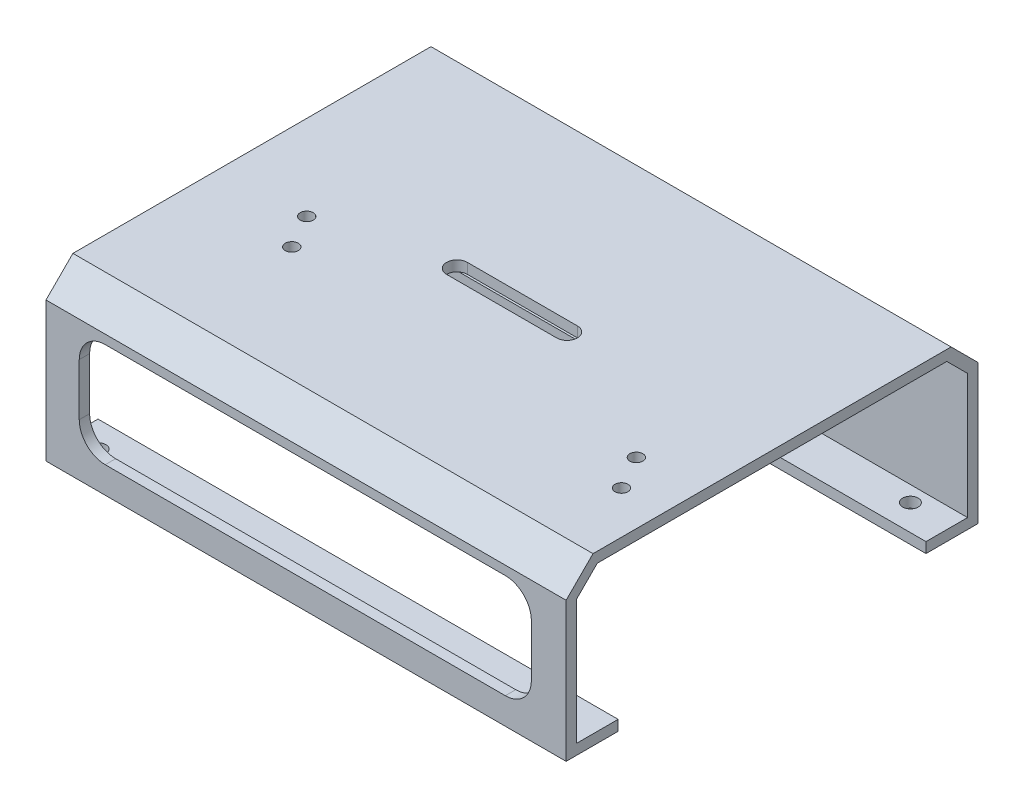
from build123d import *

# Parameters (mm, degrees)
BOSS_EXTRUDE1_DEPTH = 100
SKETCH5_R           = 1.5
CUT_EXTRUDE3_DEPTH  = 4
CUT_EXTRUDE5_REACH  = 130.673
CUT_EXTRUDE6_REACH  = 115.839
SKETCH11_R          = 1.25
CUT_EXTRUDE4_DEPTH  = 2


with BuildPart() as part:
    # Sketch1 → Boss-Extrude1 (new body)
    with BuildSketch(Plane(origin=(0, 0, 0), x_dir=(0, 0, -1), z_dir=(1, 0, 0))):
        Polygon((-25.195982579, -13.090802774), (-33.195982579, -13.090802774), (-33.195982579, 10.909197226), (-29.195982579, 14.909197226), (37.992717903, 14.909197226), (41.992717903, 10.909197226), (41.992717903, -13.090802774), (33.992717903, -13.090802774), (33.992717903, -15.090802774), (43.992717903, -15.090802774), (43.992717903, 11.73762435), (38.821145028, 16.909197226), (-30.024409703, 16.909197226), (-35.195982579, 11.73762435), (-35.195982579, -15.090802774), (-25.195982579, -15.090802774), align=None)
    extrude(amount=BOSS_EXTRUDE1_DEPTH)

    # Sketch5 → Cut-Extrude3 (cut)
    with BuildSketch(Plane.XZ.offset(15.090802774)):
        with Locations((5, 30.195982579)):
            Circle(SKETCH5_R)
        with Locations((92, 30.195982579)):
            Circle(SKETCH5_R)
        with Locations((92, -38.992717903)):
            Circle(SKETCH5_R)
        with Locations((5, -38.992717903)):
            Circle(SKETCH5_R)
    extrude(amount=-CUT_EXTRUDE3_DEPTH, mode=Mode.SUBTRACT)

    # Sketch10 → Cut-Extrude5 (cut, up to next)
    with BuildSketch(Plane.XY.offset(35.195982579), mode=Mode.PRIVATE) as cut_extrude5_sk1:
        with BuildLine():
            Line((11.390334367, 10), (88.31435142, 10))
            ThreePointArc((88.31435142, 10), (91.849885326, 8.535533906), (93.31435142, 5))
            Line((93.31435142, 5), (93.31435142, -5))
            ThreePointArc((93.31435142, -5), (91.849885326, -8.535533906), (88.31435142, -10))
            Line((88.31435142, -10), (11.390334367, -10))
            ThreePointArc((11.390334367, -10), (7.854800461, -8.535533906), (6.390334367, -5))
            Line((6.390334367, -5), (6.390334367, 5))
            ThreePointArc((6.390334367, 5), (7.854800461, 8.535533906), (11.390334367, 10))
        make_face()
    cut_extrude5_tool1 = extrude(cut_extrude5_sk1.sketch, amount=-CUT_EXTRUDE5_REACH, mode=Mode.PRIVATE) & part.part
    add(cut_extrude5_tool1.solids().sort_by_distance((49.852343, 0, 35.195983))[0], mode=Mode.SUBTRACT)

    # Sketch11 → Cut-Extrude6 (cut, up to next)
    with BuildSketch(Plane(origin=(0, 16.909197226, 0), x_dir=(1, 0, 0), z_dir=(0, 1, 0)), mode=Mode.PRIVATE) as cut_extrude6_sk1:
        with Locations((19.971775687, -7.910031108)):
            Circle(SKETCH11_R)
    cut_extrude6_tool1 = extrude(cut_extrude6_sk1.sketch, amount=-CUT_EXTRUDE6_REACH, mode=Mode.PRIVATE) & part.part
    # Sketch11 → Cut-Extrude6 (cut, up to next)
    with BuildSketch(Plane(origin=(0, 16.909197226, 0), x_dir=(1, 0, 0), z_dir=(0, 1, 0)), mode=Mode.PRIVATE) as cut_extrude6_sk2:
        with Locations((91.79572832, -16.355424806)):
            Circle(SKETCH11_R)
    cut_extrude6_tool2 = extrude(cut_extrude6_sk2.sketch, amount=-CUT_EXTRUDE6_REACH, mode=Mode.PRIVATE) & part.part
    # Sketch11 → Cut-Extrude6 (cut, up to next)
    with BuildSketch(Plane(origin=(0, 16.909197226, 0), x_dir=(1, 0, 0), z_dir=(0, 1, 0)), mode=Mode.PRIVATE) as cut_extrude6_sk3:
        with Locations((16.318342756, -1.387534759)):
            Circle(SKETCH11_R)
    cut_extrude6_tool3 = extrude(cut_extrude6_sk3.sketch, amount=-CUT_EXTRUDE6_REACH, mode=Mode.PRIVATE) & part.part
    # Sketch11 → Cut-Extrude6 (cut, up to next)
    with BuildSketch(Plane(origin=(0, 16.909197226, 0), x_dir=(1, 0, 0), z_dir=(0, 1, 0)), mode=Mode.PRIVATE) as cut_extrude6_sk4:
        with Locations((88.142295389, -9.832928457)):
            Circle(SKETCH11_R)
    cut_extrude6_tool4 = extrude(cut_extrude6_sk4.sketch, amount=-CUT_EXTRUDE6_REACH, mode=Mode.PRIVATE) & part.part
    add(cut_extrude6_tool1.solids().sort_by_distance((19.971776, 16.909197, 7.910031))[0], mode=Mode.SUBTRACT)
    add(cut_extrude6_tool2.solids().sort_by_distance((91.795728, 16.909197, 16.355425))[0], mode=Mode.SUBTRACT)
    add(cut_extrude6_tool3.solids().sort_by_distance((16.318343, 16.909197, 1.387535))[0], mode=Mode.SUBTRACT)
    add(cut_extrude6_tool4.solids().sort_by_distance((88.142295, 16.909197, 9.832928))[0], mode=Mode.SUBTRACT)

    # Sketch7 → Cut-Extrude4 (cut)
    with BuildSketch(Plane(origin=(0, 16.909197226, 0), x_dir=(1, 0, 0), z_dir=(0, 1, 0))):
        with BuildLine():
            Line((39.419167918, 6.398367662), (60.580832082, 6.398367662))
            ThreePointArc((60.580832082, 6.398367662), (62.580832082, 4.398367662), (60.580832082, 2.398367662))
            Line((60.580832082, 2.398367662), (39.419167918, 2.398367662))
            ThreePointArc((39.419167918, 2.398367662), (37.419167918, 4.398367662), (39.419167918, 6.398367662))
        make_face()
    extrude(amount=-CUT_EXTRUDE4_DEPTH, mode=Mode.SUBTRACT)


solid = part.part
